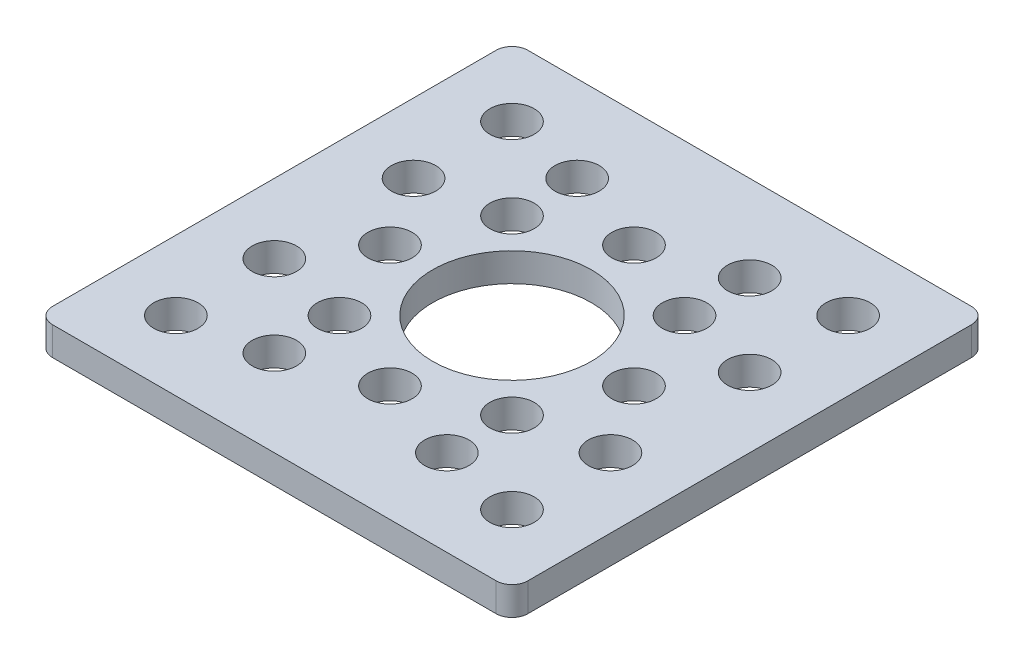
from build123d import *

# Parameters (mm, degrees)
SKETCH1_R           = 1.778
SKETCH1_R_2         = 6.3627
BOSS_EXTRUDE1_DEPTH = 2.286


with BuildPart() as part:
    # Sketch1 → Boss-Extrude1 (new body)
    with BuildSketch(Plane.XZ):
        with BuildLine():
            Line((-17.78, -19.05), (17.78, -19.05))
            ThreePointArc((17.78, -19.05), (18.678025612, -18.678025612), (19.05, -17.78))
            Line((19.05, -17.78), (19.05, 17.78))
            ThreePointArc((19.05, 17.78), (18.678025612, 18.678025612), (17.78, 19.05))
            Line((17.78, 19.05), (-17.78, 19.05))
            ThreePointArc((-17.78, 19.05), (-18.678025612, 18.678025612), (-19.05, 17.78))
            Line((-19.05, 17.78), (-19.05, -17.78))
            ThreePointArc((-19.05, -17.78), (-18.678025612, -18.678025612), (-17.78, -19.05))
        make_face()
        with Locations(Location((-13.470384182, 13.470384182, 0), (0, 0, 90))):
            Circle(SKETCH1_R, mode=Mode.SUBTRACT)
        with Locations(Location((-13.470384182, 5.579615818, 0), (0, 0, 90))):
            Circle(SKETCH1_R, mode=Mode.SUBTRACT)
        with Locations(Location((-6.914797213, -12.135202787, 0), (0, 0, 90))):
            Circle(SKETCH1_R, mode=Mode.SUBTRACT)
        with Locations(Location((13.470384182, -13.470384182, 0), (0, 0, 90))):
            Circle(SKETCH1_R, mode=Mode.SUBTRACT)
        with Locations(Location((6.914797213, 6.914797213, 0), (0, 0, 90))):
            Circle(SKETCH1_R, mode=Mode.SUBTRACT)
        with Locations(Location((0, 0, 0), (0, 0, 90))):
            Circle(SKETCH1_R_2, mode=Mode.SUBTRACT)
        with Locations(Location((9.779, 0, 0), (0, 0, 90))):
            Circle(SKETCH1_R, mode=Mode.SUBTRACT)
        with Locations(Location((6.914797213, -6.914797213, 0), (0, 0, 90))):
            Circle(SKETCH1_R, mode=Mode.SUBTRACT)
        with Locations(Location((0, -9.779, 0), (0, 0, 90))):
            Circle(SKETCH1_R, mode=Mode.SUBTRACT)
        with Locations(Location((-6.914797213, -6.914797213, 0), (0, 0, 90))):
            Circle(SKETCH1_R, mode=Mode.SUBTRACT)
        with Locations(Location((-9.779, 0, 0), (0, 0, 90))):
            Circle(SKETCH1_R, mode=Mode.SUBTRACT)
        with Locations(Location((-6.914797213, 6.914797213, 0), (0, 0, 90))):
            Circle(SKETCH1_R, mode=Mode.SUBTRACT)
        with Locations(Location((0, 9.779, 0), (0, 0, 90))):
            Circle(SKETCH1_R, mode=Mode.SUBTRACT)
        with Locations(Location((13.470384182, 5.579615818, 0), (0, 0, 90))):
            Circle(SKETCH1_R, mode=Mode.SUBTRACT)
        with Locations(Location((6.914797213, 12.135202787, 0), (0, 0, 90))):
            Circle(SKETCH1_R, mode=Mode.SUBTRACT)
        with Locations(Location((13.470384182, 13.470384182, 0), (0, 0, 90))):
            Circle(SKETCH1_R, mode=Mode.SUBTRACT)
        with Locations(Location((13.470384182, -5.579615818, 0), (0, 0, 90))):
            Circle(SKETCH1_R, mode=Mode.SUBTRACT)
        with Locations(Location((6.914797213, -12.135202787, 0), (0, 0, 90))):
            Circle(SKETCH1_R, mode=Mode.SUBTRACT)
        with Locations(Location((-13.470384182, -5.579615818, 0), (0, 0, 90))):
            Circle(SKETCH1_R, mode=Mode.SUBTRACT)
        with Locations(Location((-13.470384182, -13.470384182, 0), (0, 0, 90))):
            Circle(SKETCH1_R, mode=Mode.SUBTRACT)
        with Locations(Location((-6.914797213, 12.135202787, 0), (0, 0, 90))):
            Circle(SKETCH1_R, mode=Mode.SUBTRACT)
    extrude(amount=-BOSS_EXTRUDE1_DEPTH)


solid = part.part
